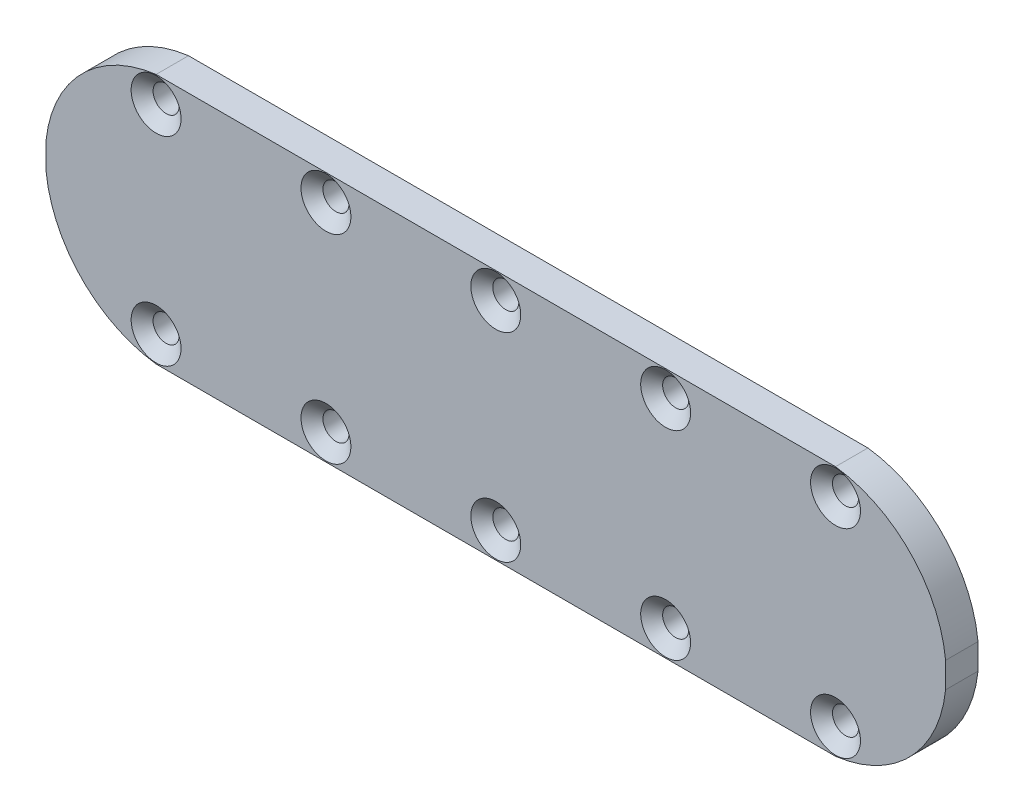
from build123d import *

# Parameters (mm, degrees)
SKETCH1_W                                          = 176.276
SKETCH1_H                                          = 49.149
BOSS_EXTRUDE1_DEPTH                                = 6.35
CUT_EXTRUDE3_DEPTH                                 = 92.719875677
CSK_FOR_10_FLAT_HEAD_MACHINE_SCREW_100_D           = 5.1054
CSK_FOR_10_FLAT_HEAD_MACHINE_SCREW_100_CSINK_D     = 9.779
CSK_FOR_10_FLAT_HEAD_MACHINE_SCREW_100_CSINK_ANGLE = 100


with BuildPart() as part:
    # Sketch1 → Boss-Extrude1 (new body)
    with BuildSketch(Plane.XY):
        Rectangle(SKETCH1_W, SKETCH1_H)
    extrude(amount=BOSS_EXTRUDE1_DEPTH)

    # Sketch22 → Cut-Extrude3 (cut, through all)
    with BuildSketch(Plane.XY.offset(6.35)):
        with BuildLine():
            ThreePointArc((-88.138, 2.504831531), (-81.209963357, 17.310760321), (-66.565807357, 24.5745))
            Line((-66.565807357, 24.5745), (-88.138, 24.5745))
            Line((-88.138, 24.5745), (-88.138, 2.504831531))
        make_face()
        with BuildLine():
            ThreePointArc((-66.565807357, -24.5745), (-81.209963357, -17.310760321), (-88.138, -2.504831531))
            Line((-88.138, -2.504831531), (-88.138, -24.5745))
            Line((-88.138, -24.5745), (-66.565807357, -24.5745))
        make_face()
        with BuildLine():
            Line((88.138, -24.5745), (88.138, -2.504831531))
            ThreePointArc((88.138, -2.504831531), (81.209963357, -17.310760321), (66.565807357, -24.5745))
            Line((66.565807357, -24.5745), (88.138, -24.5745))
        make_face()
        with BuildLine():
            Line((88.138, 24.5745), (66.565807357, 24.5745))
            ThreePointArc((66.565807357, 24.5745), (81.209963357, 17.310760321), (88.138, 2.504831531))
            Line((88.138, 2.504831531), (88.138, 24.5745))
        make_face()
    extrude(amount=-CUT_EXTRUDE3_DEPTH, mode=Mode.SUBTRACT)

    # CSK for #10 Flat Head Machine Screw (100)1 (through all)
    with Locations(Plane.XY.offset(6.35)):
        with Locations((-66.565807357, 19.4945), (-33.282903678, 19.4945), (0, 19.4945), (33.282903678, 19.4945), (66.565807357, 19.4945), (66.565807357, -19.4945), (33.282903678, -19.4945), (0, -19.4945), (-33.282903678, -19.4945), (-66.565807357, -19.4945)):
            CounterSinkHole(CSK_FOR_10_FLAT_HEAD_MACHINE_SCREW_100_D / 2, CSK_FOR_10_FLAT_HEAD_MACHINE_SCREW_100_CSINK_D / 2, counter_sink_angle=CSK_FOR_10_FLAT_HEAD_MACHINE_SCREW_100_CSINK_ANGLE)


solid = part.part
